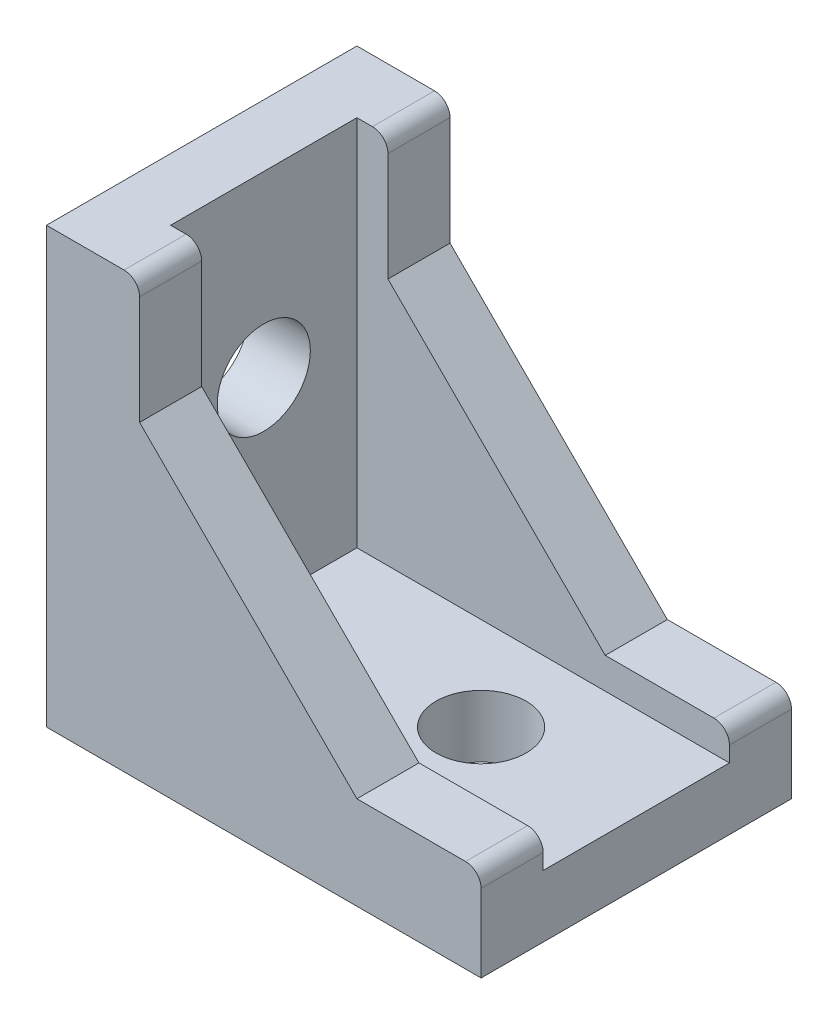
from build123d import *

# Parameters (mm, degrees)
BOSS_EXTRUDE1_DEPTH = 20
SKETCH2_W           = 36.386493836
SKETCH2_H           = 30.590666468
CUT_EXTRUDE1_DEPTH  = 6
SKETCH4_R           = 3
CUT_EXTRUDE2_DEPTH  = 12
SKETCH5_R           = 2.9
CUT_EXTRUDE3_DEPTH  = 12
FILLET1_R           = 1


with BuildPart() as part:
    # Sketch1 → Boss-Extrude1 (new body)
    with BuildSketch(Plane.XY):
        Polygon((-25.115207597, 31.4260495), (-25.115207597, 3.4260495), (2.884792403, 3.4260495), (2.884792403, 9.4260495), (-5.115207597, 9.4260495), (-19.115207597, 23.4260495), (-19.115207597, 31.4260495), align=None)
    extrude(amount=BOSS_EXTRUDE1_DEPTH)

    # Sketch2 → Cut-Extrude1 (cut, symmetric)
    with BuildSketch(Plane.XY.offset(10)):
        with Locations((-2.921960679, 22.721382734)):
            Rectangle(SKETCH2_W, SKETCH2_H)
    extrude(amount=CUT_EXTRUDE1_DEPTH, both=True, mode=Mode.SUBTRACT)

    # Sketch4 → Cut-Extrude2 (cut)
    with BuildSketch(Plane(origin=(-21.115207597, 0, 0), x_dir=(0, 0, -1), z_dir=(1, 0, 0))):
        with Locations((-10, 19.9260495)):
            Circle(SKETCH4_R)
    extrude(amount=-CUT_EXTRUDE2_DEPTH, mode=Mode.SUBTRACT)

    # Sketch5 → Cut-Extrude3 (cut)
    with BuildSketch(Plane(origin=(0, 7.4260495, 0), x_dir=(1, 0, 0), z_dir=(0, 1, 0))):
        with Locations(Location((-7.115207597, -10, 0), (0, 0, 180))):
            Circle(SKETCH5_R)
    extrude(amount=-CUT_EXTRUDE3_DEPTH, mode=Mode.SUBTRACT)

    # Fillet1
    fillet1_edges = [part.edges().sort_by_distance(p)[0] for p in [
        (-19.115207597, 31.4260495, 18),
        (2.884792403, 9.4260495, 18),
        (-19.115207597, 31.4260495, 2),
        (2.884792403, 9.4260495, 2),
    ]]
    fillet(fillet1_edges, radius=FILLET1_R)


solid = part.part
